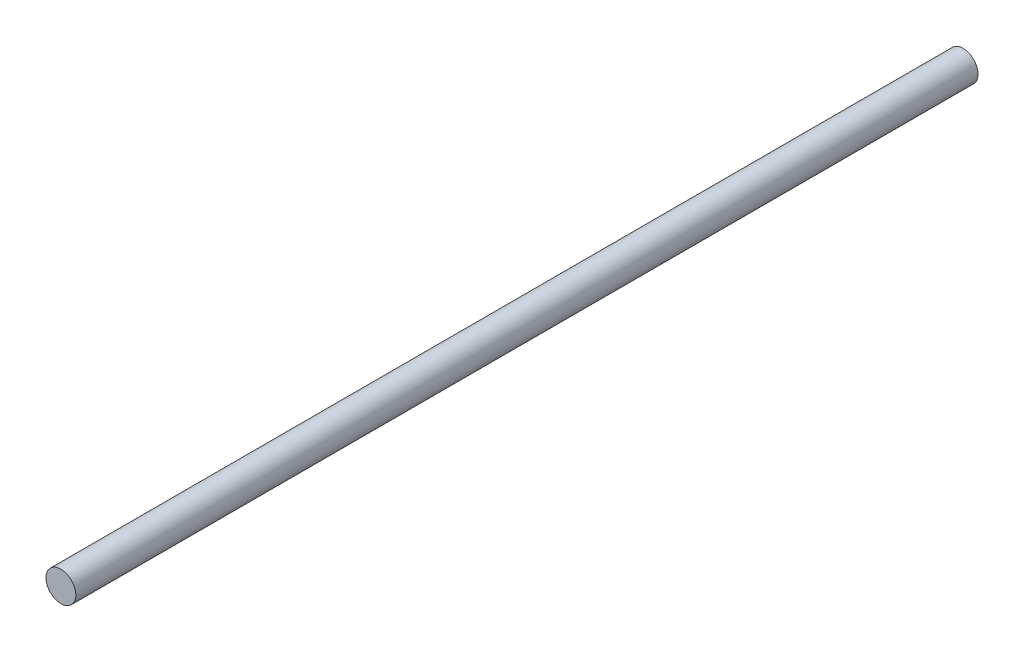
from build123d import *

# Parameters (mm, degrees)
SKETCH1_R           = 4
BOSS_EXTRUDE1_DEPTH = 241.52


with BuildPart() as part:
    # Sketch1 → Boss-Extrude1 (new body)
    with BuildSketch(Plane.XY):
        Circle(SKETCH1_R)
    extrude(amount=BOSS_EXTRUDE1_DEPTH)


solid = part.part
